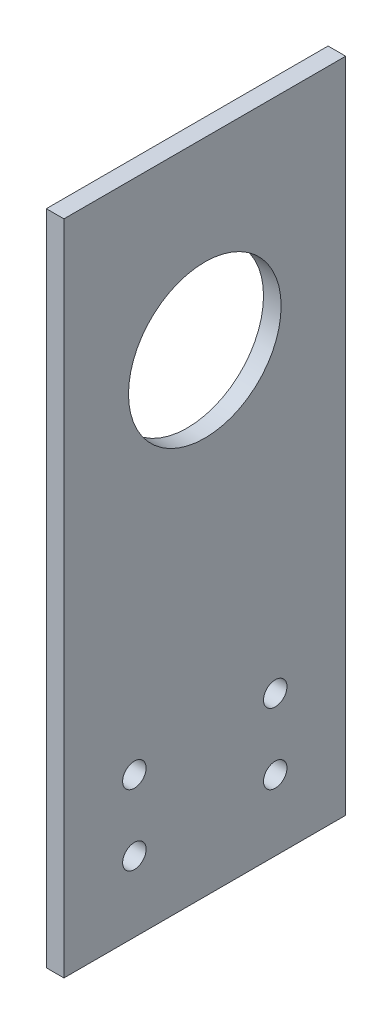
from build123d import *

# Parameters (mm, degrees)
SKETCH1_W           = 76.2
SKETCH1_H           = 177.8
BOSS_EXTRUDE1_DEPTH = 4.7625
CUT_EXTRUDE1_REACH  = 98.838
SKETCH2_R           = 20.6375
CUT_EXTRUDE2_REACH  = 98.838
SKETCH4_R           = 3.175


with BuildPart() as part:
    # Sketch1 → Boss-Extrude1 (new body)
    with BuildSketch(Plane(origin=(0, 0, 0), x_dir=(0, 0, -1), z_dir=(1, 0, 0))):
        Rectangle(SKETCH1_W, SKETCH1_H)
    extrude(amount=BOSS_EXTRUDE1_DEPTH)

    # Sketch2 → Cut-Extrude1 (cut, up to next)
    with BuildSketch(Plane(origin=(4.7625, 0, 0), x_dir=(0, 0, -1), z_dir=(1, 0, 0)), mode=Mode.PRIVATE) as cut_extrude1_sk1:
        with Locations((0, 39.116)):
            Circle(SKETCH2_R)
    cut_extrude1_tool1 = extrude(cut_extrude1_sk1.sketch, amount=-CUT_EXTRUDE1_REACH, mode=Mode.PRIVATE) & part.part
    add(cut_extrude1_tool1.solids().sort_by_distance((4.7625, 39.116, 0))[0], mode=Mode.SUBTRACT)

    # Sketch4 → Cut-Extrude2 (cut, up to next)
    with BuildSketch(Plane(origin=(4.7625, 0, 0), x_dir=(0, 0, -1), z_dir=(1, 0, 0)), mode=Mode.PRIVATE) as cut_extrude2_sk1:
        with Locations((-19.05, -50.8)):
            Circle(SKETCH4_R)
    cut_extrude2_tool1 = extrude(cut_extrude2_sk1.sketch, amount=-CUT_EXTRUDE2_REACH, mode=Mode.PRIVATE) & part.part
    # Sketch4 → Cut-Extrude2 (cut, up to next)
    with BuildSketch(Plane(origin=(4.7625, 0, 0), x_dir=(0, 0, -1), z_dir=(1, 0, 0)), mode=Mode.PRIVATE) as cut_extrude2_sk2:
        with Locations((19.05, -50.8)):
            Circle(SKETCH4_R)
    cut_extrude2_tool2 = extrude(cut_extrude2_sk2.sketch, amount=-CUT_EXTRUDE2_REACH, mode=Mode.PRIVATE) & part.part
    # Sketch4 → Cut-Extrude2 (cut, up to next)
    with BuildSketch(Plane(origin=(4.7625, 0, 0), x_dir=(0, 0, -1), z_dir=(1, 0, 0)), mode=Mode.PRIVATE) as cut_extrude2_sk3:
        with Locations((19.05, -69.85)):
            Circle(SKETCH4_R)
    cut_extrude2_tool3 = extrude(cut_extrude2_sk3.sketch, amount=-CUT_EXTRUDE2_REACH, mode=Mode.PRIVATE) & part.part
    # Sketch4 → Cut-Extrude2 (cut, up to next)
    with BuildSketch(Plane(origin=(4.7625, 0, 0), x_dir=(0, 0, -1), z_dir=(1, 0, 0)), mode=Mode.PRIVATE) as cut_extrude2_sk4:
        with Locations((-19.05, -69.85)):
            Circle(SKETCH4_R)
    cut_extrude2_tool4 = extrude(cut_extrude2_sk4.sketch, amount=-CUT_EXTRUDE2_REACH, mode=Mode.PRIVATE) & part.part
    add(cut_extrude2_tool1.solids().sort_by_distance((4.7625, -50.8, 19.05))[0], mode=Mode.SUBTRACT)
    add(cut_extrude2_tool2.solids().sort_by_distance((4.7625, -50.8, -19.05))[0], mode=Mode.SUBTRACT)
    add(cut_extrude2_tool3.solids().sort_by_distance((4.7625, -69.85, -19.05))[0], mode=Mode.SUBTRACT)
    add(cut_extrude2_tool4.solids().sort_by_distance((4.7625, -69.85, 19.05))[0], mode=Mode.SUBTRACT)


solid = part.part
